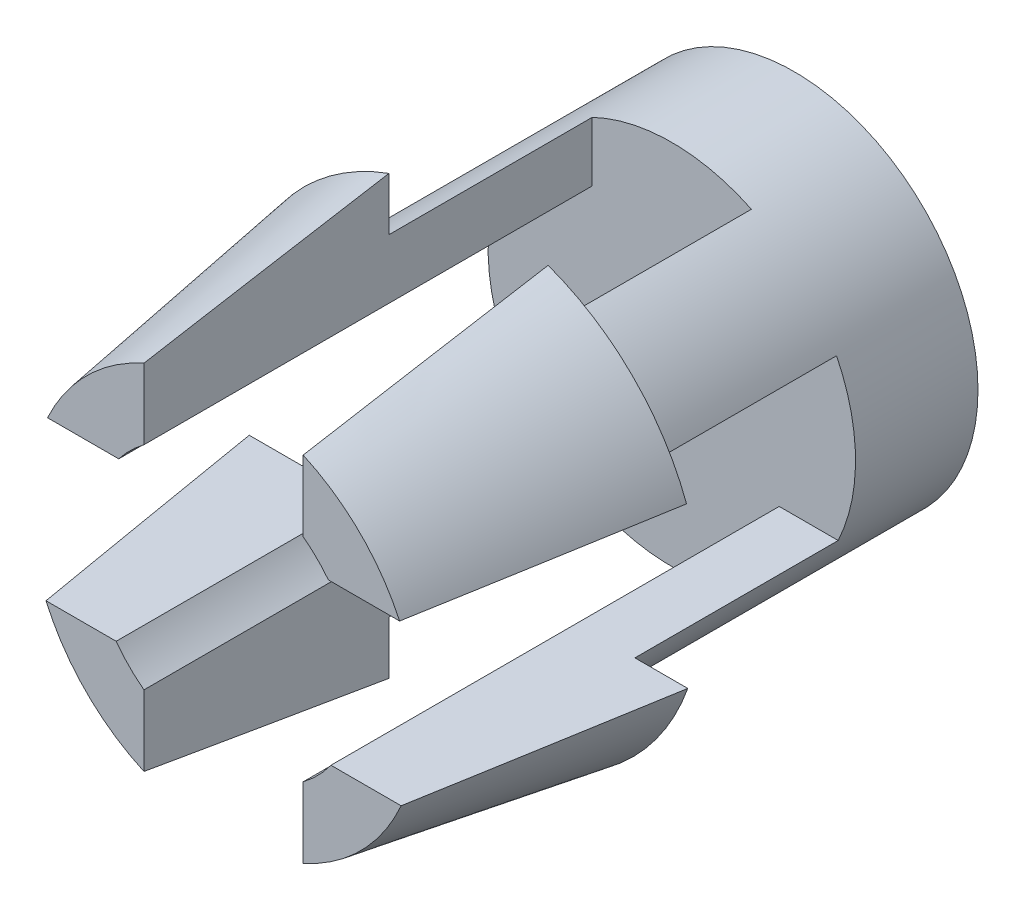
from build123d import *

# Parameters (mm, degrees)
SKETCH2_R           = 1.5
BOSS_EXTRUDE1_DEPTH = 2.66
SKETCH3_R           = 1.9
BOSS_EXTRUDE2_DEPTH = 2
BOSS_EXTRUDE2_TAPER = 9
CUT_EXTRUDE1_DEPTH  = 3.66


with BuildPart() as part:
    # Sketch2 → Boss-Extrude1 (new body)
    with BuildSketch(Plane.XY):
        Circle(SKETCH2_R)
    extrude(amount=BOSS_EXTRUDE1_DEPTH)

    # Sketch3 → Boss-Extrude2 (add)
    with BuildSketch(Plane.XY.offset(2.66)):
        Circle(SKETCH3_R)
    extrude(amount=BOSS_EXTRUDE2_DEPTH, taper=BOSS_EXTRUDE2_TAPER)

    # Sketch4 → Cut-Extrude1 (cut)
    with BuildSketch(Plane.XY.offset(4.66)):
        with BuildLine():
            Line((-0.649990442, 2.221316651), (0.649990442, 2.221316651))
            Line((0.649990442, 2.221316651), (0.649990442, 0.866546066))
            ThreePointArc((0.649990442, 0.866546066), (0.759799587, 0.7720714), (0.856021376, 0.663789923))
            Line((0.856021376, 0.663789923), (2.381309482, 0.663789923))
            Line((2.381309482, 0.663789923), (2.381309482, -0.63619096))
            Line((2.381309482, -0.63619096), (0.876727278, -0.63619096))
            ThreePointArc((0.876727278, -0.63619096), (0.771999105, -0.759873042), (0.649990442, -0.866546066))
            Line((0.649990442, -0.866546066), (0.649990442, -2.221316651))
            Line((0.649990442, -2.221316651), (-0.649990442, -2.221316651))
            Line((-0.649990442, -2.221316651), (-0.649990442, -0.866546066))
            ThreePointArc((-0.649990442, -0.866546066), (-0.771994962, -0.759877251), (-0.876720342, -0.636200519))
            Line((-0.876720342, -0.636200519), (-2.381309482, -0.636200519))
            Line((-2.381309482, -0.636200519), (-2.381309482, 0.663799481))
            Line((-2.381309482, 0.663799481), (-0.856013964, 0.663799481))
            ThreePointArc((-0.856013964, 0.663799481), (-0.759795276, 0.772075642), (-0.649990442, 0.866546066))
            Line((-0.649990442, 0.866546066), (-0.649990442, 2.221316651))
        make_face()
    extrude(amount=-CUT_EXTRUDE1_DEPTH, mode=Mode.SUBTRACT)


solid = part.part
